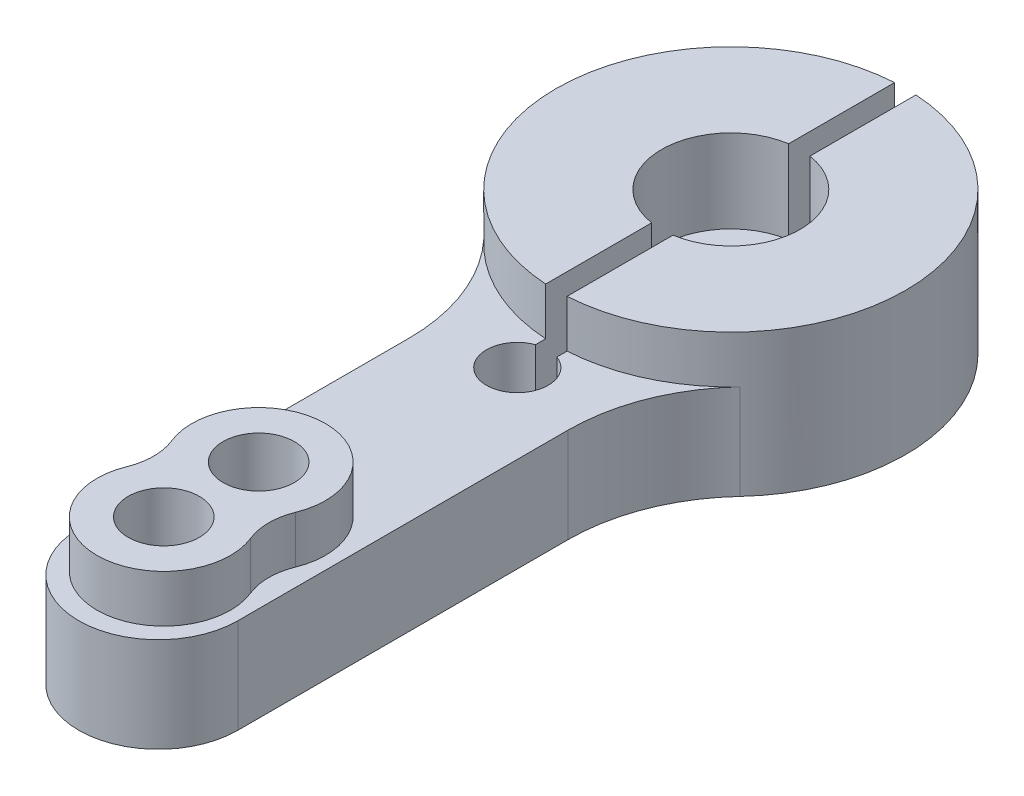
from build123d import *

# Parameters (mm, degrees)
SKETCH1_R           = 1.5000000000000018
SKETCH1_R_2         = 1.5000000000000004
BOSS_EXTRUDE1_DEPTH = 4
BOSS_EXTRUDE2_START = 2
BOSS_EXTRUDE2_DEPTH = 2
BOSS_EXTRUDE3_START = 2
SKETCH3_R           = 1.5000000000000007
SKETCH3_R_2         = 1.500000000000001
BOSS_EXTRUDE3_DEPTH = 2
SKETCH4_R           = 2.921
CUT_EXTRUDE1_DEPTH  = 3.5052
FILLET1_R           = 7.62
SKETCH5_R           = 3.8735000000000004
CUT_EXTRUDE2_DEPTH  = 1.3716


with BuildPart() as part:
    # Sketch1 → Boss-Extrude1 (new body)
    with BuildSketch(Plane(origin=(0, 0, 0), x_dir=(1, 0, 0), z_dir=(0, 1, 0))):
        with BuildLine():
            Line((-3.3528000000000002, -24.130000000000003), (-3.3527999999999993, -6.55871086113727))
            ThreePointArc((-3.3527999999999993, -6.55871086113727), (-7.210684523422123, 1.504654346911835), (-0.45, 7.352241562952077))
            Line((-0.45, 7.352241562952077), (-0.45, 1.325707358356285))
            ThreePointArc((-0.45, 1.325707358356285), (-1.4, 1.7e-16), (-0.45, -1.325707358356285))
            Line((-0.45, -1.325707358356285), (-0.45, -7.780368908234952))
            ThreePointArc((-0.45, -7.780368908234952), (-2.4e-16, -10.3), (0.45000000000000184, -7.780368908234953))
            Line((0.45000000000000184, -7.780368908234953), (0.45000000000000107, -1.3257073583562848))
            ThreePointArc((0.45000000000000107, -1.3257073583562848), (1.4, 0), (0.45000000000000073, 1.3257073583562848))
            Line((0.45000000000000073, 1.3257073583562848), (0.45, 7.352241562952076))
            ThreePointArc((0.45, 7.352241562952076), (7.210684523422123, 1.504654346911832), (3.3527999999999993, -6.55871086113727))
            Line((3.3527999999999993, -6.55871086113727), (3.3528000000000002, -24.130000000000003))
            ThreePointArc((3.3528000000000002, -24.130000000000003), (-6.2e-16, -27.482800000000005), (-3.3528000000000002, -24.130000000000003))
        make_face()
        with Locations(Location((-4.6e-16, -23.9, 0), (0, 0, 270))):
            Circle(SKETCH1_R, mode=Mode.SUBTRACT)
        with Locations(Location((0, -19.9, 0), (0, 0, 270))):
            Circle(SKETCH1_R_2, mode=Mode.SUBTRACT)
    extrude(amount=-BOSS_EXTRUDE1_DEPTH)

    # Sketch2 → Boss-Extrude2 (add)
    with BuildSketch(Plane(origin=(0, 0, 0), x_dir=(1, 0, 0), z_dir=(0, 1, 0)).offset(BOSS_EXTRUDE2_START)):
        with BuildLine():
            Line((-0.44999999999999873, 7.352241562952076), (-0.4499999999999986, 1.325707358356285))
            ThreePointArc((-0.4499999999999986, 1.325707358356285), (-1.3999999999999995, 1.7e-16), (-0.4499999999999986, -1.3257073583562848))
            Line((-0.4499999999999986, -1.3257073583562848), (-0.44999999999999873, -7.352241562952076))
            ThreePointArc((-0.44999999999999873, -7.352241562952076), (-7.366, 9e-16), (-0.44999999999999873, 7.352241562952076))
        make_face()
        with BuildLine():
            Line((0.45, 7.352241562952076), (0.4499999999999999, 1.3257073583562846))
            ThreePointArc((0.4499999999999999, 1.3257073583562846), (1.3999999999999995, 0), (0.4499999999999999, -1.3257073583562846))
            Line((0.4499999999999999, -1.3257073583562846), (0.45, -7.352241562952076))
            ThreePointArc((0.45, -7.352241562952076), (7.366, 0), (0.45, 7.352241562952076))
        make_face()
    extrude(amount=-BOSS_EXTRUDE2_DEPTH)

    # Sketch3 → Boss-Extrude3 (add)
    with BuildSketch(Plane(origin=(0, 0, 0), x_dir=(1, 0, 0), z_dir=(0, 1, 0)).offset(BOSS_EXTRUDE3_START)):
        with BuildLine():
            ThreePointArc((2.611298533252736, -20.95135387488328), (8e-16, -17.085), (-2.6112985332527363, -20.95135387488328))
            ThreePointArc((-2.6112985332527363, -20.95135387488328), (-2.427496854553608, -21.899999999999995), (-2.611298533252737, -22.84864612511671))
            ThreePointArc((-2.611298533252737, -22.84864612511671), (-9.8e-16, -26.715), (2.611298533252737, -22.84864612511671))
            ThreePointArc((2.611298533252737, -22.84864612511671), (2.427496854553609, -21.899999999999995), (2.611298533252736, -20.95135387488328))
        make_face()
        with Locations(Location((0, -19.9, 0), (0, 0, 270))):
            Circle(SKETCH3_R, mode=Mode.SUBTRACT)
        with Locations(Location((-4.6e-16, -23.9, 0), (0, 0, 270))):
            Circle(SKETCH3_R_2, mode=Mode.SUBTRACT)
    extrude(amount=-BOSS_EXTRUDE3_DEPTH)

    # Sketch4 → Cut-Extrude1 (cut)
    with BuildSketch(Plane(origin=(0, 2, 0), x_dir=(1, 0, 0), z_dir=(0, 1, 0))):
        Circle(SKETCH4_R)
    extrude(amount=-CUT_EXTRUDE1_DEPTH, mode=Mode.SUBTRACT)

    # Fillet1
    fillet1_edges = [part.edges().sort_by_distance(p)[0] for p in [
        (-3.3527999999999993, -2, 6.558710861137271),
        (3.352800000000001, -2, 6.55871086113727),
    ]]
    fillet(fillet1_edges, radius=FILLET1_R)

    # Sketch5 → Cut-Extrude2 (cut)
    with BuildSketch(Plane.XZ.offset(4)):
        Circle(SKETCH5_R)
    extrude(amount=-CUT_EXTRUDE2_DEPTH, mode=Mode.SUBTRACT)


solid = part.part
